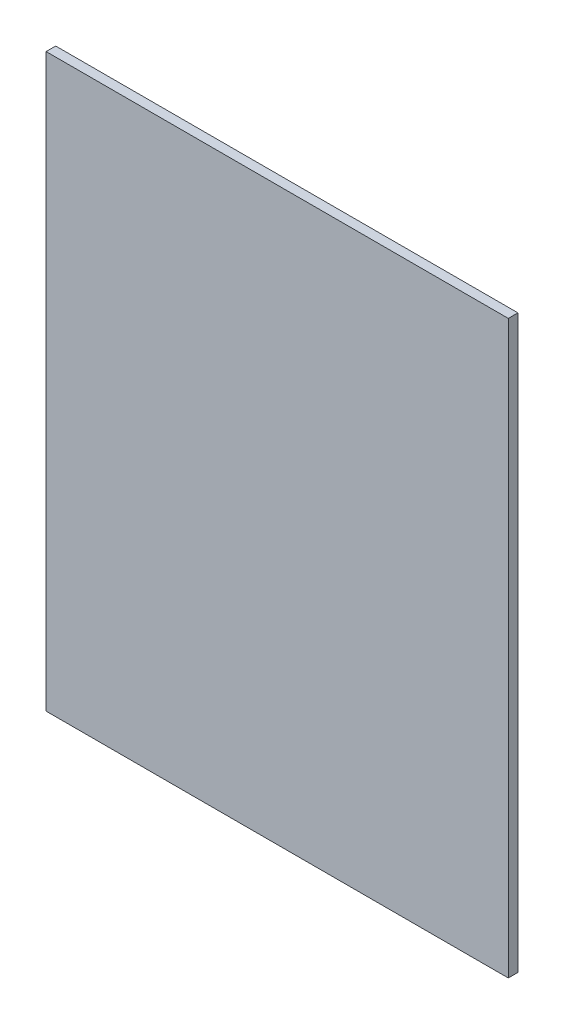
from build123d import *

# Parameters (mm, degrees)
SKETCH1_W           = 877.8875
SKETCH1_H           = 1085.05625
BOSS_EXTRUDE1_DEPTH = 18.25625


with BuildPart() as part:
    # Sketch1 → Boss-Extrude1 (new body)
    with BuildSketch(Plane.XY):
        Rectangle(SKETCH1_W, SKETCH1_H)
    extrude(amount=BOSS_EXTRUDE1_DEPTH)


solid = part.part
